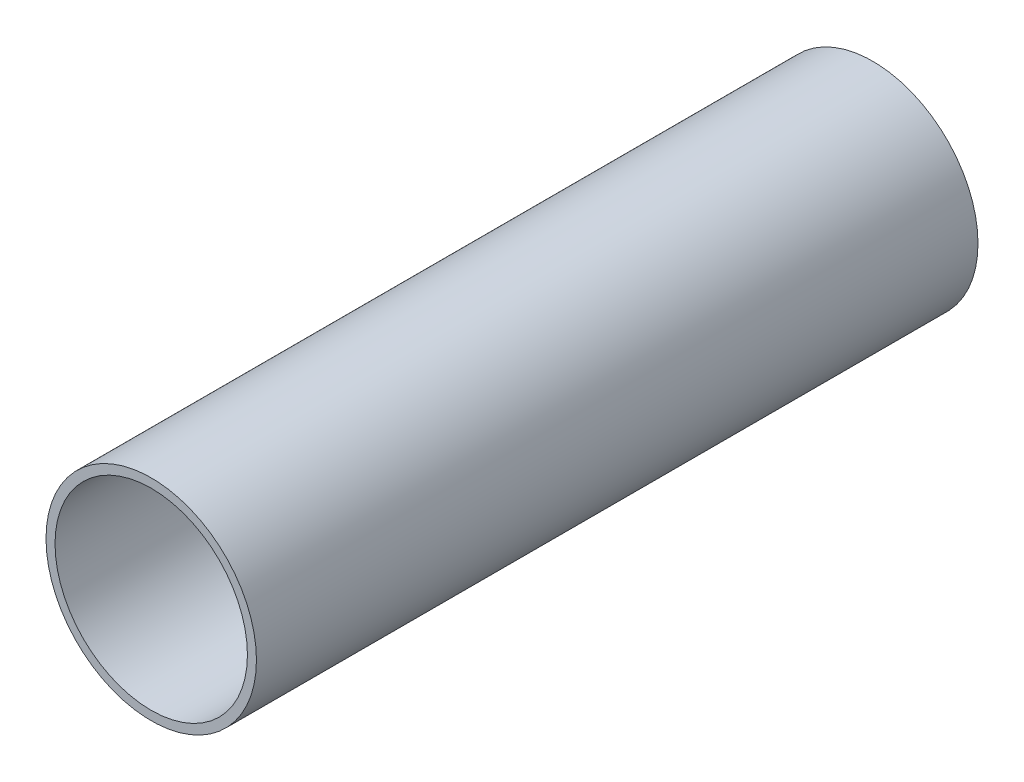
from build123d import *

# Parameters (mm, degrees)
SKETCH_1_R      = 8.75
SKETCH_1_R_2    = 8
EXTRUDE_1_DEPTH = 60


with BuildPart() as part:
    # Эскиз1 → Вытянуть-Тонкостенный1 (new body)
    with BuildSketch(Plane.XY):
        Circle(SKETCH_1_R)
        Circle(SKETCH_1_R_2, mode=Mode.SUBTRACT)
    extrude(amount=EXTRUDE_1_DEPTH)


solid = part.part
